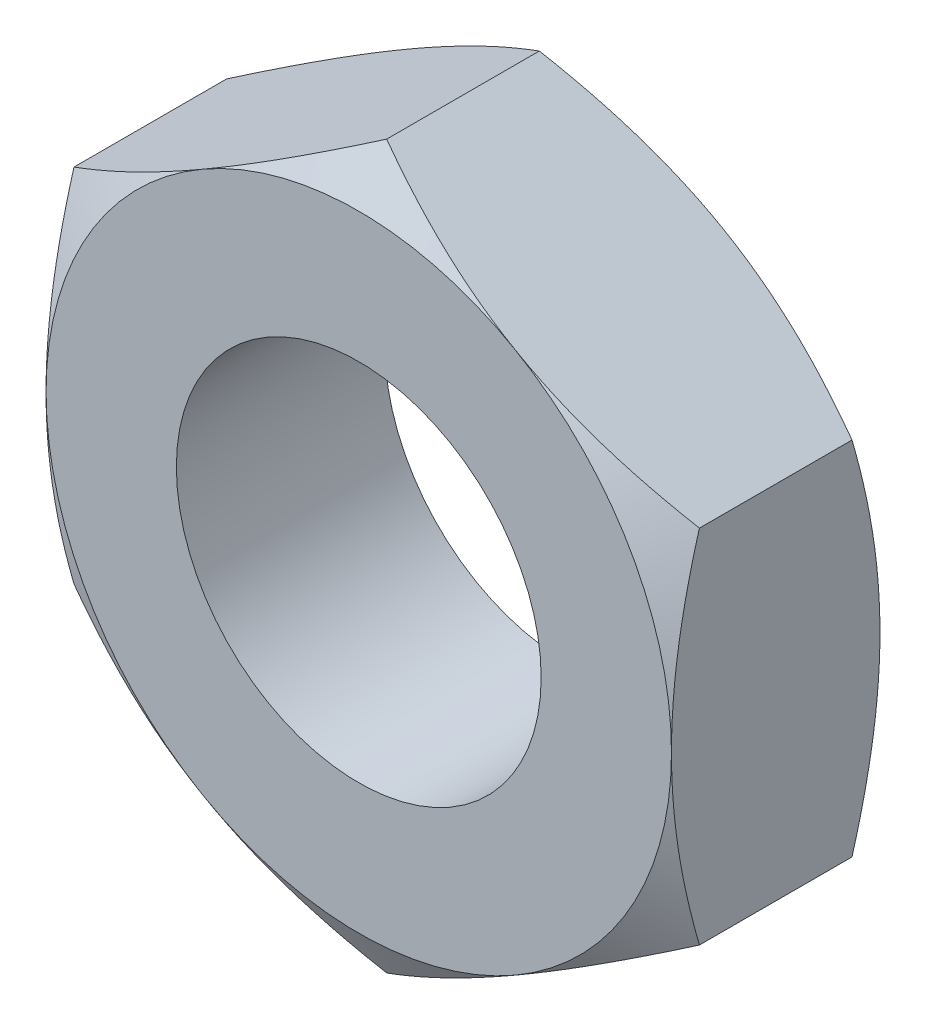
from build123d import *

# Parameters (mm, degrees)
BASIS_LINEAR_AUSTRAGEN_DEPTH = 8
BOHRUNG1_D                   = 14


with BuildPart() as part:
    # Skizze1 → Basis-Linear austragen (new body)
    with BuildSketch(Plane.XY):
        Polygon((0, -13.856406461), (12, -6.92820323), (12, 6.92820323), (0, 13.856406461), (-12, 6.92820323), (-12, -6.92820323), align=None)
    extrude(amount=BASIS_LINEAR_AUSTRAGEN_DEPTH)

    # Skizze2 → Schnitt-Rotation1 (revolve, cut)
    with BuildSketch(Plane(origin=(0, 0, 0), x_dir=(0, 0, -1), z_dir=(1, 0, 0))):
        Polygon((-8, 12), (-6.92820323, 13.856406461), (-1.07179677, 13.856406461), (0, 12), (0, 14.856406461), (-8, 14.856406461), align=None)
    revolve(axis=Axis((0, 0, -0.921105868), (0, 0, 1)), mode=Mode.SUBTRACT)

    # Bohrung1 (through all)
    with Locations(Plane.XY.offset(8)):
        with Locations((0, 0)):
            Hole(BOHRUNG1_D / 2)


solid = part.part
